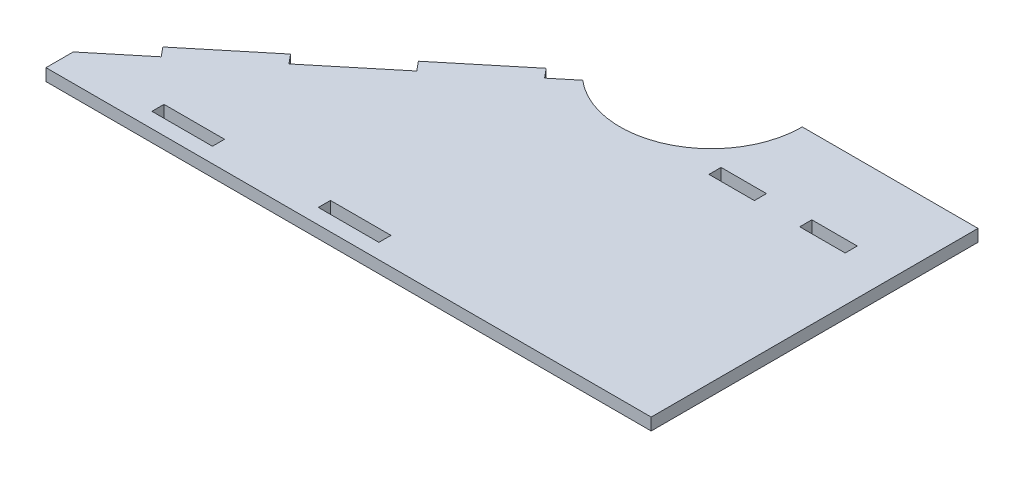
from build123d import *

# Parameters (mm, degrees)
SKETCH1_W           = 200
SKETCH1_H           = 108
BOSS_EXTRUDE1_DEPTH = 4
CUT_EXTRUDE1_DEPTH  = 228.332355814
SKETCH4_W           = 30
SKETCH4_H           = 4
BOSS_EXTRUDE2_DEPTH = 4
SKETCH5_W           = 15
SKETCH5_H           = 4
SKETCH5_W_2         = 20
CUT_EXTRUDE2_DEPTH  = 228.332355814
SKETCH6_R           = 30.118776273
CUT_EXTRUDE4_DEPTH  = 228.332355814


with BuildPart() as part:
    # Sketch1 → Boss-Extrude1 (new body)
    with BuildSketch(Plane(origin=(0, 0, 0), x_dir=(1, 0, 0), z_dir=(0, 1, 0))):
        with Locations((100, 54)):
            Rectangle(SKETCH1_W, SKETCH1_H)
    extrude(amount=BOSS_EXTRUDE1_DEPTH)

    # Sketch3 → Cut-Extrude1 (cut, through all)
    with BuildSketch(Plane(origin=(0, 4, 0), x_dir=(1, 0, 0), z_dir=(0, 1, 0))):
        Polygon((120.09925776, 108), (0, 9), (0, 108), align=None)
    extrude(amount=-CUT_EXTRUDE1_DEPTH, mode=Mode.SUBTRACT)

    # Sketch4 → Boss-Extrude2 (add)
    with BuildSketch(Plane(origin=(-4.417303696, 0, -5.358736315), x_dir=(-0.7716314833522663, 0, 0.6360698498589453), z_dir=(-0.6360698498589453, 0, -0.7716314833522663))):
        with Locations((-101.3679122, 2)):
            Rectangle(SKETCH4_W, SKETCH4_H)
        with Locations((-41.3679122, 2)):
            Rectangle(SKETCH4_W, SKETCH4_H)
    extrude(amount=BOSS_EXTRUDE2_DEPTH)

    # Sketch5 → Cut-Extrude2 (cut, through all)
    with BuildSketch(Plane(origin=(0, 4, 0), x_dir=(1, 0, 0), z_dir=(0, 1, 0))):
        with Locations((177.594068765, 80.999936793)):
            Rectangle(SKETCH5_W, SKETCH5_H)
        with Locations((147.594068765, 80.999936793)):
            Rectangle(SKETCH5_W, SKETCH5_H)
        with Locations((95, 7)):
            Rectangle(SKETCH5_W_2, SKETCH5_H)
        with Locations((40, 7)):
            Rectangle(SKETCH5_W_2, SKETCH5_H)
    extrude(amount=-CUT_EXTRUDE2_DEPTH, mode=Mode.SUBTRACT)

    # Sketch6 → Cut-Extrude4 (cut, through all)
    with BuildSketch(Plane(origin=(0, 4, 0), x_dir=(1, 0, 0), z_dir=(0, 1, 0))):
        with Locations((111.819464, 108)):
            Circle(SKETCH6_R)
    extrude(amount=-CUT_EXTRUDE4_DEPTH, mode=Mode.SUBTRACT)


solid = part.part
